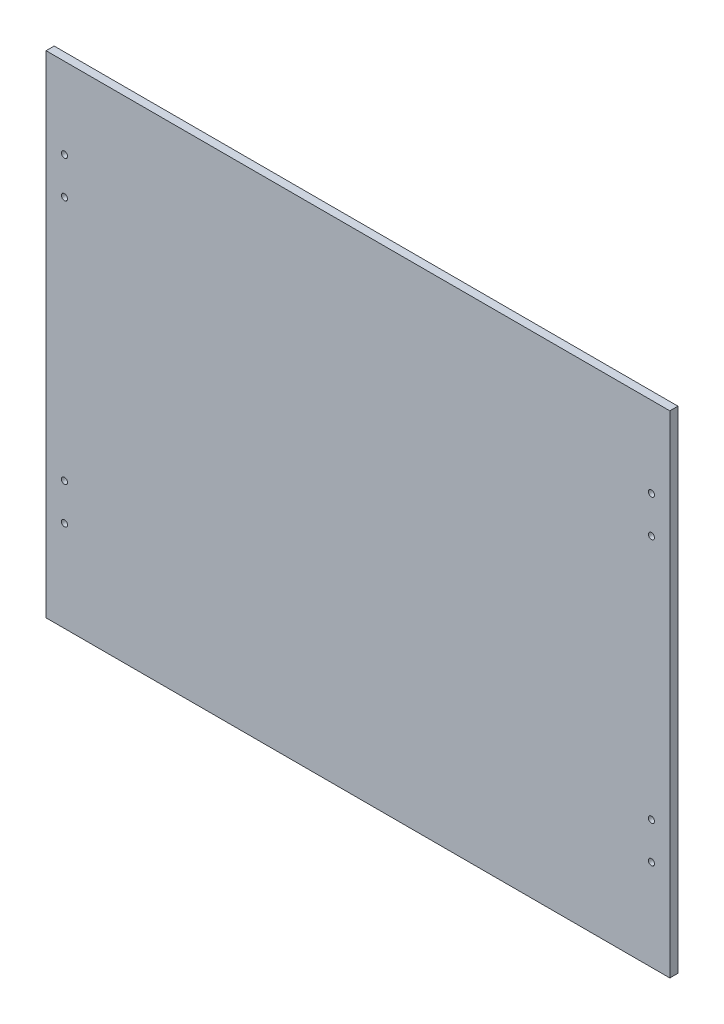
from build123d import *

# Parameters (mm, degrees)
SKETCH1_W           = 254
SKETCH1_H           = 200
SKETCH1_R           = 1.25
BOSS_EXTRUDE1_DEPTH = 3.3


with BuildPart() as part:
    # Sketch1 → Boss-Extrude1 (new body)
    with BuildSketch(Plane.XY):
        with Locations((11.545454545, 17.928571429)):
            Rectangle(SKETCH1_W, SKETCH1_H)
        with Locations((-107.954545455, 85.028571429)):
            Circle(SKETCH1_R, mode=Mode.SUBTRACT)
        with Locations((-107.954545455, 70.028571429)):
            Circle(SKETCH1_R, mode=Mode.SUBTRACT)
        with Locations((131.045454545, 85.028571429)):
            Circle(SKETCH1_R, mode=Mode.SUBTRACT)
        with Locations((131.045454545, 70.028571429)):
            Circle(SKETCH1_R, mode=Mode.SUBTRACT)
        with Locations((-107.954545455, -29.971428571)):
            Circle(SKETCH1_R, mode=Mode.SUBTRACT)
        with Locations((131.045454545, -29.971428571)):
            Circle(SKETCH1_R, mode=Mode.SUBTRACT)
        with Locations((-107.954545455, -44.971428571)):
            Circle(SKETCH1_R, mode=Mode.SUBTRACT)
        with Locations((131.045454545, -44.971428571)):
            Circle(SKETCH1_R, mode=Mode.SUBTRACT)
    extrude(amount=BOSS_EXTRUDE1_DEPTH)


solid = part.part
